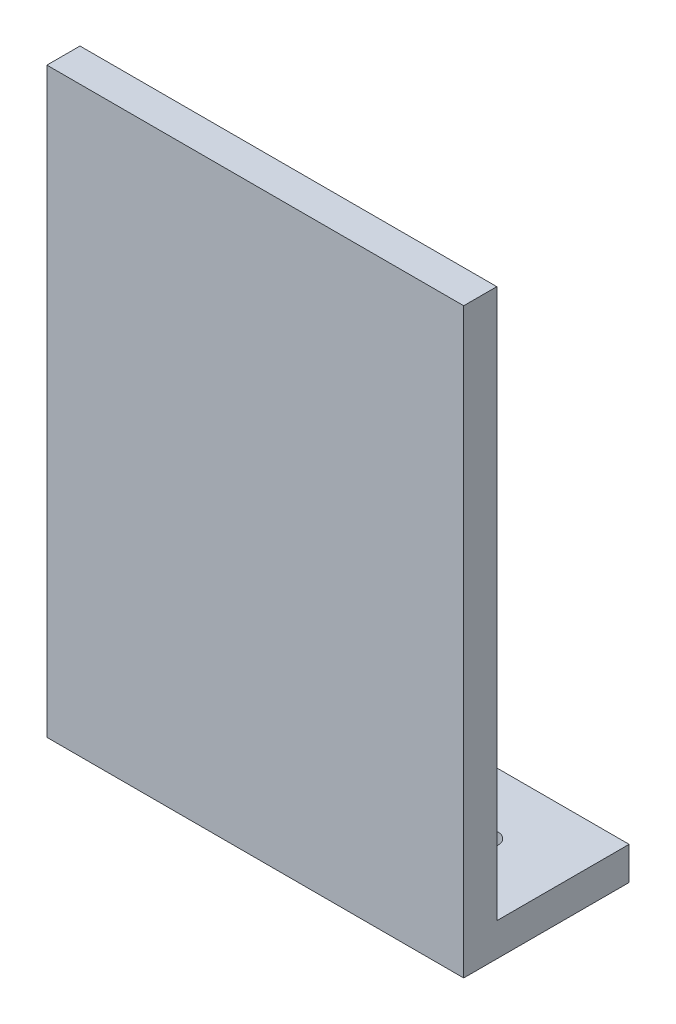
from build123d import *

# Parameters (mm, degrees)
SKETCH1_W           = 63
SKETCH1_H           = 88
BOSS_EXTRUDE1_DEPTH = 5
SKETCH2_W           = 63
SKETCH2_H           = 5
BOSS_EXTRUDE2_DEPTH = 20
SKETCH3_R           = 1.7
CUT_EXTRUDE1_DEPTH  = 107.103722838


with BuildPart() as part:
    # Sketch1 → Boss-Extrude1 (new body)
    with BuildSketch(Plane.XY):
        with Locations((31.5, 44)):
            Rectangle(SKETCH1_W, SKETCH1_H)
    extrude(amount=BOSS_EXTRUDE1_DEPTH)

    # Sketch2 → Boss-Extrude2 (add)
    with BuildSketch(Plane(origin=(0, 0, 0), x_dir=(-1, 0, 0), z_dir=(0, 0, -1))):
        with Locations((-31.5, 2.5)):
            Rectangle(SKETCH2_W, SKETCH2_H)
    extrude(amount=BOSS_EXTRUDE2_DEPTH)

    # Sketch3 → Cut-Extrude1 (cut, through all)
    with BuildSketch(Plane(origin=(0, 5, 0), x_dir=(1, 0, 0), z_dir=(0, 1, 0))):
        with Locations(Location((51.5, 10, 0), (0, 0, 180))):
            Circle(SKETCH3_R)
        with Locations(Location((11.5, 10, 0), (0, 0, 180))):
            Circle(SKETCH3_R)
    extrude(amount=-CUT_EXTRUDE1_DEPTH, mode=Mode.SUBTRACT)


solid = part.part
